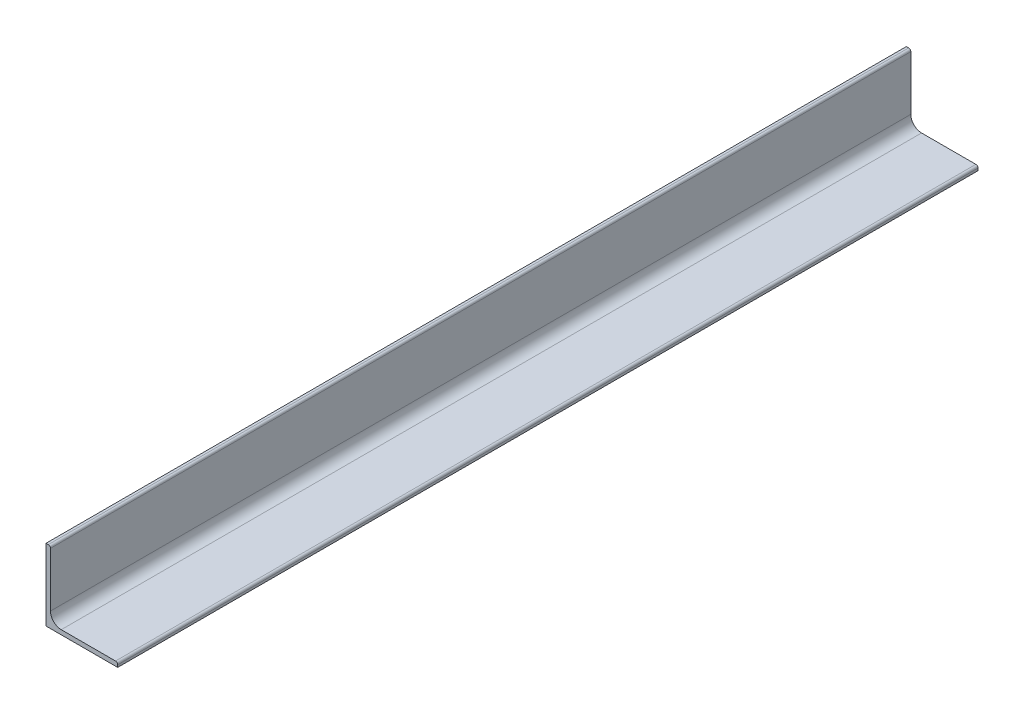
from build123d import *

# Parameters (mm, degrees)
BOSS_EXTRUDE1_DEPTH = 1219.2


with BuildPart() as part:
    # Sketch3 → Boss-Extrude1 (new body)
    with BuildSketch(Plane.XY):
        with BuildLine():
            Line((0, 15.24), (0, 92.202))
            ThreePointArc((0, 92.202), (-0.892738531, 94.357261469), (-3.048, 95.25))
            Line((-3.048, 95.25), (-6.35, 95.25))
            Line((-6.35, 95.25), (-6.35, -5.334))
            ThreePointArc((-6.35, -5.334), (-6.05242049, -6.05242049), (-5.334, -6.35))
            Line((-5.334, -6.35), (95.25, -6.35))
            Line((95.25, -6.35), (95.25, -3.048))
            ThreePointArc((95.25, -3.048), (94.357261469, -0.892738531), (92.202, 0))
            Line((92.202, 0), (15.24, 0))
            ThreePointArc((15.24, 0), (4.463692655, 4.463692655), (0, 15.24))
        make_face()
    extrude(amount=BOSS_EXTRUDE1_DEPTH)


solid = part.part
